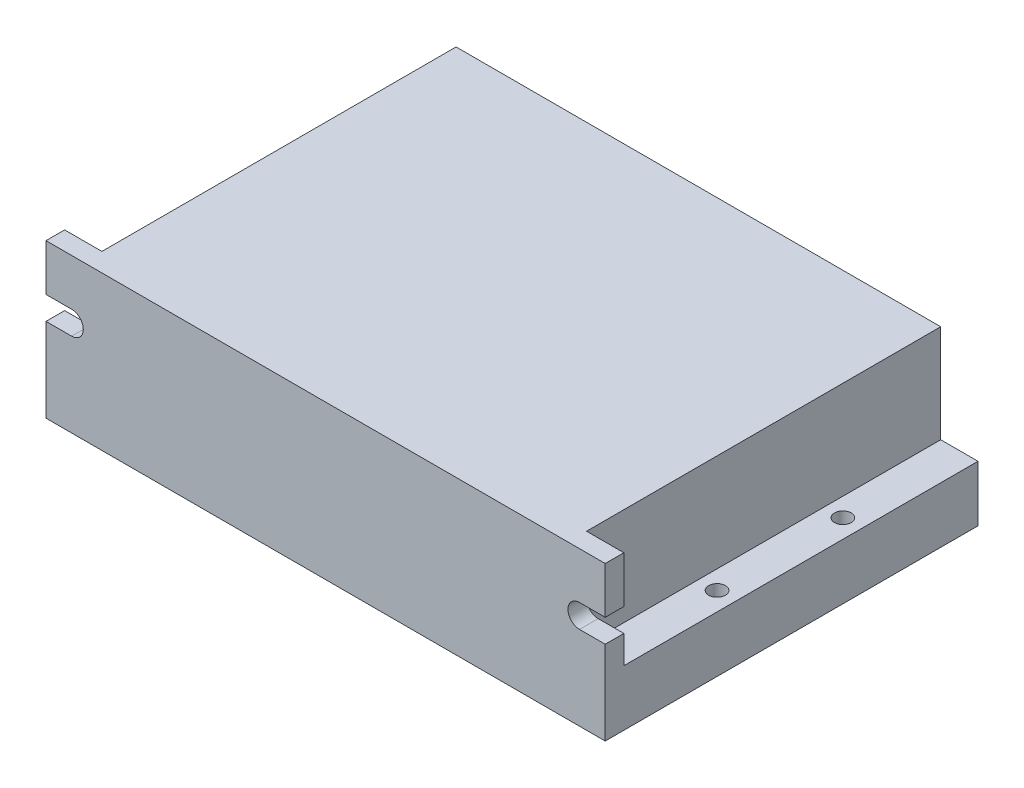
from build123d import *

# Parameters (mm, degrees)
SKETCH1_W           = 120
SKETCH1_H           = 80
BOSS_EXTRUDE1_DEPTH = 33
SKETCH2_W           = 8
SKETCH2_H           = 76
CUT_EXTRUDE1_DEPTH  = 21
SKETCH3_R           = 1.8
CUT_EXTRUDE2_DEPTH  = 76.106590923
SKETCH4_R           = 2.5
CUT_EXTRUDE3_DEPTH  = 106.304320899


with BuildPart() as part:
    # Sketch1 → Boss-Extrude1 (new body)
    with BuildSketch(Plane(origin=(0, 0, 0), x_dir=(1, 0, 0), z_dir=(0, 1, 0))):
        Rectangle(SKETCH1_W, SKETCH1_H)
    extrude(amount=BOSS_EXTRUDE1_DEPTH)

    # Sketch2 → Cut-Extrude1 (cut)
    with BuildSketch(Plane(origin=(0, 33, 0), x_dir=(1, 0, 0), z_dir=(0, 1, 0))):
        with Locations((-56, 2)):
            Rectangle(SKETCH2_W, SKETCH2_H)
    cut_extrude1 = extrude(amount=-CUT_EXTRUDE1_DEPTH, mode=Mode.SUBTRACT)

    # Sketch3 → Cut-Extrude2 (cut, through all)
    with BuildSketch(Plane(origin=(0, 12, 0), x_dir=(1, 0, 0), z_dir=(0, 1, 0))):
        with Locations(Location((-56, 15, 0), (0, 0, 270))):
            Circle(SKETCH3_R)
        with Locations(Location((-56, -12, 0), (0, 0, 270))):
            Circle(SKETCH3_R)
    cut_extrude2 = extrude(amount=-CUT_EXTRUDE2_DEPTH, mode=Mode.SUBTRACT)

    # Sketch4 → Cut-Extrude3 (cut, through all)
    with BuildSketch(Plane.XY.offset(40)):
        with Locations((-54.5, 20.5)):
            Circle(SKETCH4_R)
        with BuildLine():
            Line((-54.5, 23), (-60, 23))
            Line((-60, 23), (-60, 18))
            Line((-60, 18), (-54.5, 18))
            ThreePointArc((-54.5, 18), (-57, 20.5), (-54.5, 23))
        make_face()
    cut_extrude3 = extrude(amount=-CUT_EXTRUDE3_DEPTH, mode=Mode.SUBTRACT)

    # Mirror1: Cut-Extrude1, Cut-Extrude2, Cut-Extrude3 across plane
    add(cut_extrude1.mirror(Plane(origin=(0, 0, 0), x_dir=(0, 0, 1), z_dir=(1, 0, 0))), mode=Mode.SUBTRACT)
    add(cut_extrude2.mirror(Plane(origin=(0, 0, 0), x_dir=(0, 0, 1), z_dir=(1, 0, 0))), mode=Mode.SUBTRACT)
    add(cut_extrude3.mirror(Plane(origin=(0, 0, 0), x_dir=(0, 0, 1), z_dir=(1, 0, 0))), mode=Mode.SUBTRACT)


solid = part.part
